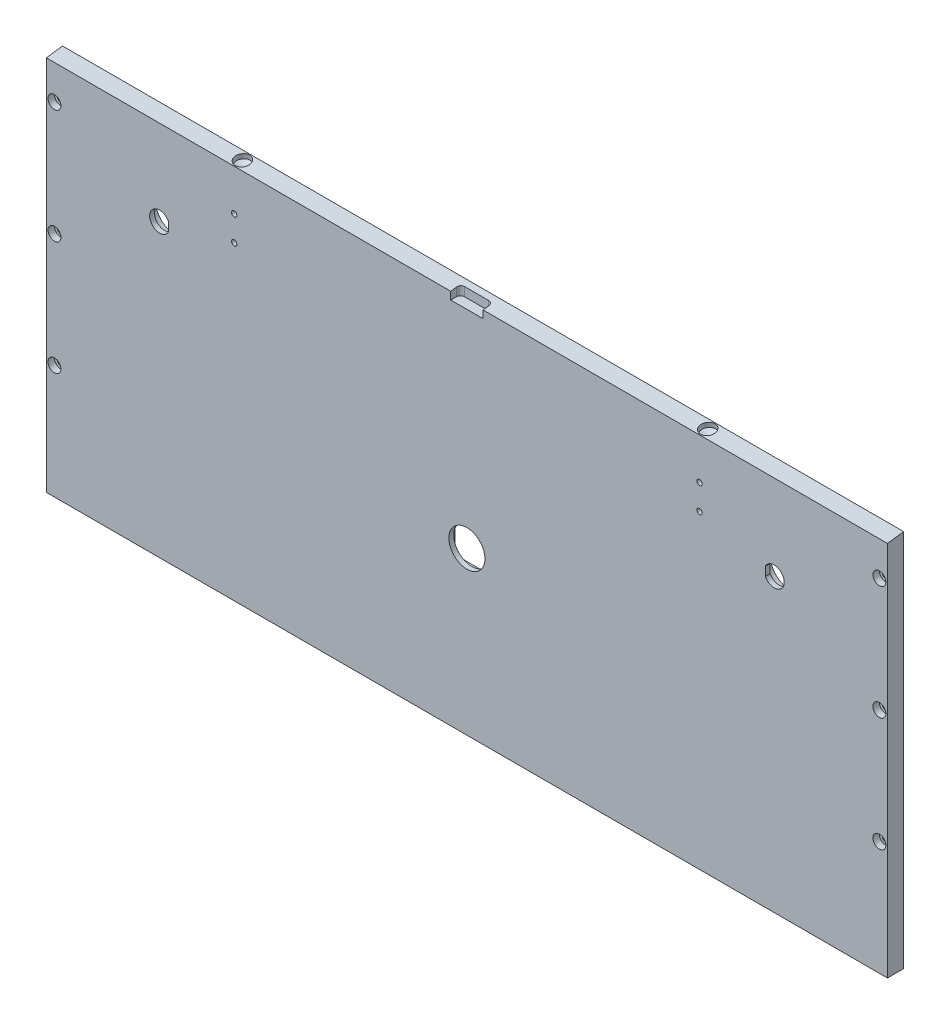
from build123d import *

# Parameters (mm, degrees)
SKETCH1_W                     = 520
SKETCH1_H                     = 234
BOSS_EXTRUDE1_DEPTH           = 10
SKETCH8_W                     = 20
SKETCH8_H                     = 8
CUT_EXTRUDE5_DEPTH            = 6
FILLET2_R                     = 2.5
CUT_EXTRUDE7_DEPTH            = 571.312195205
M4X0_7_TAPPED_HOLE1_D         = 3.3
M4X0_7_TAPPED_HOLE1_DEPTH     = 12
M4X0_7_TAPPED_HOLE1_TIP       = 0.991420021
CBORE_FOR_M4_SHCS1_AT_2_COUNT = 2
CBORE_FOR_M4_SHCS1_AT_2_PITCH = 70.5
CBORE_FOR_M4_SHCS1_AT_3_COUNT = 2
CBORE_FOR_M4_SHCS1_AT_3_PITCH = 141
M4X0_7_TAPPED_HOLE2_D         = 3.3
SKETCH18_R                    = 11.15
CUT_EXTRUDE8_DEPTH            = 571.312195205
SKETCH19_W                    = 35
SKETCH19_H                    = 47
CUT_EXTRUDE9_DEPTH            = 7
FILLET3_R                     = 2
CUT_EXTRUDE10_DEPTH           = 571.312195205
SKETCH21_R                    = 12.5
CUT_EXTRUDE11_DEPTH           = 7


with BuildPart() as part:
    # Sketch1 → Boss-Extrude1 (new body)
    with BuildSketch(Plane.XY):
        with Locations((260, 117)):
            Rectangle(SKETCH1_W, SKETCH1_H)
    extrude(amount=BOSS_EXTRUDE1_DEPTH)

    # Sketch8 → Cut-Extrude5 (cut)
    with BuildSketch(Plane.XY.offset(10)):
        with Locations((260, 232)):
            Rectangle(SKETCH8_W, SKETCH8_H)
    extrude(amount=-CUT_EXTRUDE5_DEPTH, mode=Mode.SUBTRACT)

    # Fillet2
    fillet2_edges = [part.edges().sort_by_distance(p)[0] for p in [
        (270, 231, 4),
        (250, 231, 4),
    ]]
    fillet(fillet2_edges, radius=FILLET2_R)

    # Sketch9 → Cut-Extrude7 (cut, through all)
    with BuildSketch(Plane(origin=(0, 0, 0), x_dir=(0, 0, -1), z_dir=(1, 0, 0))):
        Polygon((0, 234), (-10, 232.685250563), (-10, 234), align=None)
    extrude(amount=CUT_EXTRUDE7_DEPTH, mode=Mode.SUBTRACT)

    # M4x0.7 Tapped Hole1
    with Locations(Plane(origin=(0, 0, 0), x_dir=(-1, 0, 0), z_dir=(0, -1, 0))):
        with Locations((-70, -5), (-260, -5), (-450, -5)):
            Hole(M4X0_7_TAPPED_HOLE1_D / 2, depth=M4X0_7_TAPPED_HOLE1_DEPTH)
            with Locations((0, 0, -(M4X0_7_TAPPED_HOLE1_DEPTH + M4X0_7_TAPPED_HOLE1_TIP / 2))):  # 118° drill point
                Cone(0, M4X0_7_TAPPED_HOLE1_D / 2, M4X0_7_TAPPED_HOLE1_TIP, mode=Mode.SUBTRACT)

    # Sketch13 → CBORE for M4 SHCS1 (revolve, cut)
    with BuildSketch(Plane(origin=(5, 211.5, 10), x_dir=(0, -1, 0), z_dir=(1, 0, 0))):
        Polygon((0, 0), (0, 13.351936393), (2.25, 12), (2.25, 4), (4, 4), (4, 0), align=None)
    cbore_for_m4_shcs1 = revolve(axis=Axis((5, 211.5, 16.35), (0, 0, -1)), mode=Mode.SUBTRACT)

    # CBORE for M4 SHCS1 at 2: CBORE for M4 SHCS1 ×2
    with Locations(*[(0, -i * CBORE_FOR_M4_SHCS1_AT_2_PITCH, 0) for i in range(1, CBORE_FOR_M4_SHCS1_AT_2_COUNT)]):
        add(cbore_for_m4_shcs1, mode=Mode.SUBTRACT)

    # CBORE for M4 SHCS1 at 3: CBORE for M4 SHCS1 ×2
    with Locations(*[(0, -i * CBORE_FOR_M4_SHCS1_AT_3_PITCH, 0) for i in range(1, CBORE_FOR_M4_SHCS1_AT_3_COUNT)]):
        add(cbore_for_m4_shcs1, mode=Mode.SUBTRACT)

    # Mirror1: CBORE for M4 SHCS1 across plane
    add(cbore_for_m4_shcs1.mirror(Plane.ZY.offset(-260)), mode=Mode.SUBTRACT)

    # Mirror1 copy 1 sketch → Mirror1 copy 1 (revolve, cut)
    with BuildSketch(Plane(origin=(515, 141, 10), x_dir=(0, -1, 0), z_dir=(-1, 0, 0))):
        Polygon((0, 0), (0, -13.351936393), (2.25, -12), (2.25, -4), (4, -4), (4, 0), align=None)
    revolve(axis=Axis((515, 141, 16.35), (0, 0, 1)), mode=Mode.SUBTRACT)

    # Mirror1 copy 2 sketch → Mirror1 copy 2 (revolve, cut)
    with BuildSketch(Plane(origin=(515, 70.5, 10), x_dir=(0, -1, 0), z_dir=(-1, 0, 0))):
        Polygon((0, 0), (0, -13.351936393), (2.25, -12), (2.25, -4), (4, -4), (4, 0), align=None)
    revolve(axis=Axis((515, 70.5, 16.35), (0, 0, 1)), mode=Mode.SUBTRACT)

    # M4x0.7 Tapped Hole2 (through all)
    with Locations(Plane.XY.offset(10)):
        with Locations((116.15, 207.185250563), (116.15, 191.685250563)):
            m4x0_7_tapped_hole2 = Hole(M4X0_7_TAPPED_HOLE2_D / 2)

    # Mirror2: M4x0.7 Tapped Hole2 across plane
    add(m4x0_7_tapped_hole2.mirror(Plane.ZY.offset(-260)), mode=Mode.SUBTRACT)

    # Sketch17 → Ø9.0 (9) Diameter Hole1 (revolve, cut)
    with BuildSketch(Plane(origin=(116.15, 233.348234248, 4.957338137), x_dir=(0, -0.1303531504610662, 0.9914676273912701), z_dir=(1, 0, 0))):
        Polygon((0, 0), (0, 5.703872786), (4.5, 3), (4.5, 0), align=None)
    f_9_0_9_diameter_hole1 = revolve(axis=Axis((116.15, 239.644053682, 5.785080642), (0, -0.9914676273912703, -0.13035315046106621)), mode=Mode.SUBTRACT)

    # Mirror5: Ø9.0 (9) Diameter Hole1 across plane
    add(f_9_0_9_diameter_hole1.mirror(Plane.ZY.offset(-260)), mode=Mode.SUBTRACT)

    # Sketch18 → Cut-Extrude8 (cut, through all)
    with BuildSketch(Plane.XY.offset(10)):
        with Locations((260, 100)):
            Circle(SKETCH18_R)
    extrude(amount=-CUT_EXTRUDE8_DEPTH, mode=Mode.SUBTRACT)

    # Sketch19 → Cut-Extrude9 (cut)
    with BuildSketch(Plane(origin=(0, 0, 0), x_dir=(-1, 0, 0), z_dir=(0, 0, -1))):
        with Locations((-260, 106.5)):
            Rectangle(SKETCH19_W, SKETCH19_H)
    extrude(amount=-CUT_EXTRUDE9_DEPTH, mode=Mode.SUBTRACT)

    # Fillet3
    fillet3_edges = [part.edges().sort_by_distance(p)[0] for p in [
        (277.5, 83, 3.5),
        (277.5, 130, 3.5),
        (242.5, 130, 3.5),
        (242.5, 83, 3.5),
    ]]
    fillet(fillet3_edges, radius=FILLET3_R)

    # Sketch20 → Cut-Extrude10 (cut, through all)
    with BuildSketch(Plane(origin=(0, 0, 0), x_dir=(-1, 0, 0), z_dir=(0, 0, -1))):
        with BuildLine():
            Line((-75.5, 177.248182419), (-75.5, 182.751817581))
            ThreePointArc((-75.5, 182.751817581), (-63.85, 180), (-75.5, 177.248182419))
        make_face()
    cut_extrude10 = extrude(amount=-CUT_EXTRUDE10_DEPTH, mode=Mode.SUBTRACT)

    # Mirror6: Cut-Extrude10 across plane
    add(cut_extrude10.mirror(Plane.ZY.offset(-260)), mode=Mode.SUBTRACT)

    # Sketch21 → Cut-Extrude11 (cut)
    with BuildSketch(Plane(origin=(0, 0, 0), x_dir=(-1, 0, 0), z_dir=(0, 0, -1))):
        with Locations((-70, 180)):
            Circle(SKETCH21_R)
    cut_extrude11 = extrude(amount=-CUT_EXTRUDE11_DEPTH, mode=Mode.SUBTRACT)

    # Mirror7: Cut-Extrude11 across plane
    add(cut_extrude11.mirror(Plane.ZY.offset(-260)), mode=Mode.SUBTRACT)


solid = part.part
